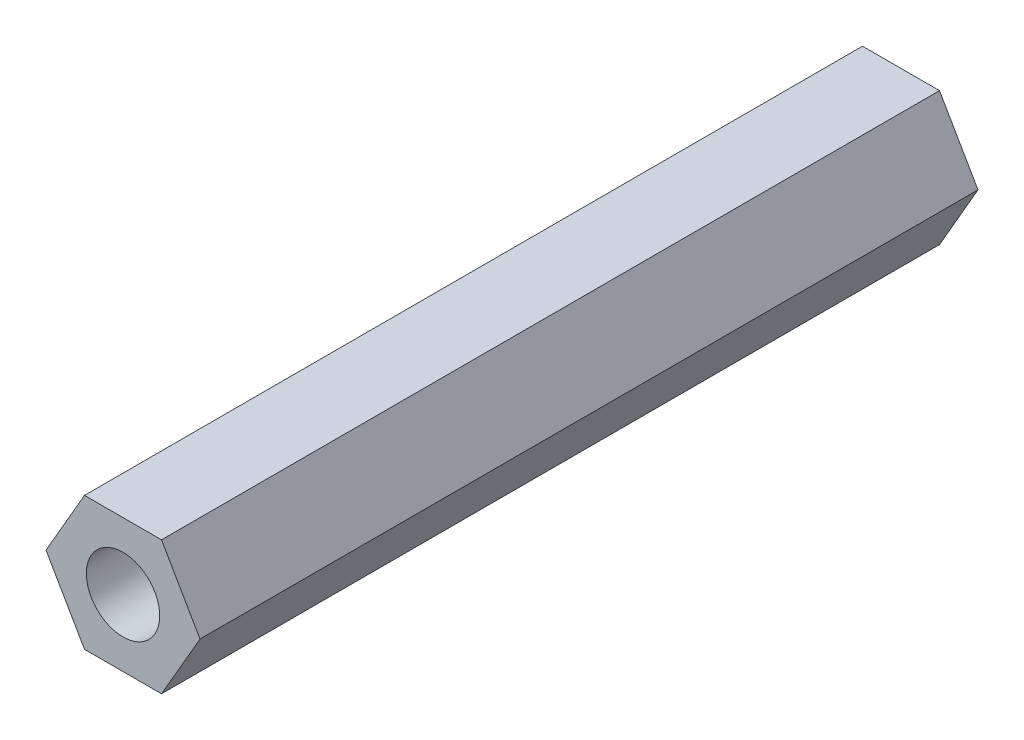
from build123d import *

# Parameters (mm, degrees)
EXTRUDE_1_DEPTH    = 35
HOLE_WIZARD_M4_1_D = 3.3


with BuildPart() as part:
    # 草图1 → 凸台-拉伸1 (new body)
    with BuildSketch(Plane.XY):
        Polygon((0, 0), (3.464101615, 0), (5.196152423, -3), (3.464101615, -6), (0, -6), (-1.732050808, -3), align=None)
    extrude(amount=EXTRUDE_1_DEPTH)

    # M4 螺纹孔1 (through all)
    with Locations(Plane.XY.offset(35)):
        with Locations((1.732050808, -3)):
            Hole(HOLE_WIZARD_M4_1_D / 2)


solid = part.part
